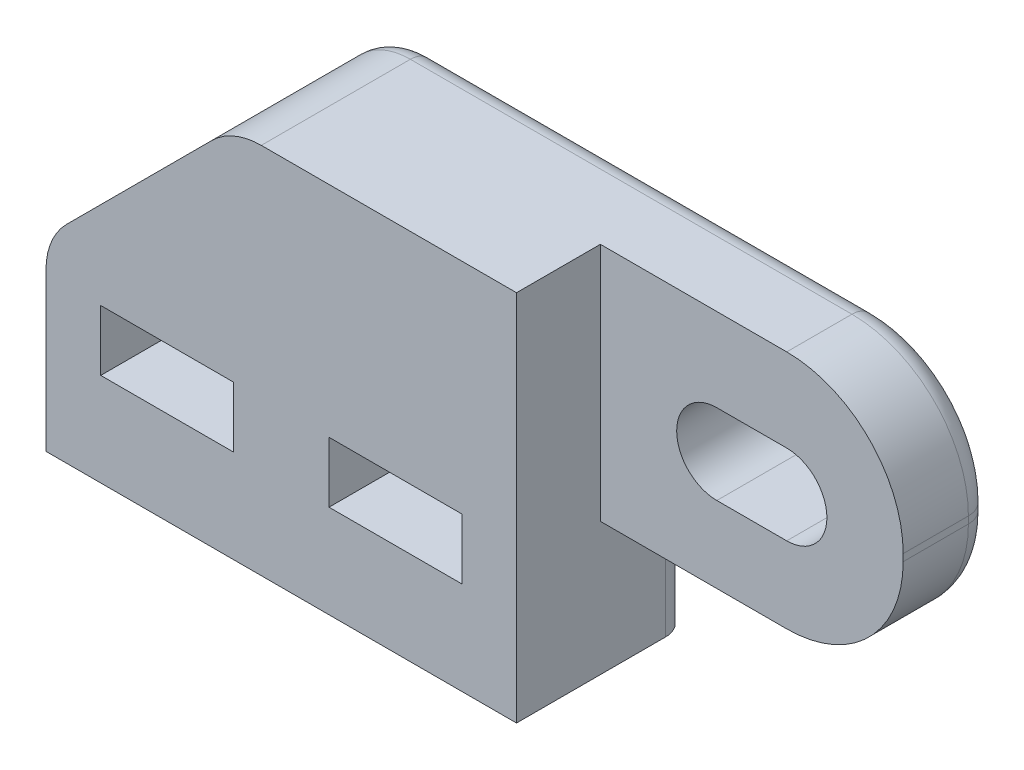
from build123d import *

# Parameters (mm, degrees)
BOSS_EXTRUDE1_DEPTH = 7.4
CUT_EXTRUDE1_REACH  = 39.59
SKETCH2_W           = 3.6
SKETCH2_H           = 10.3
SKETCH4_R           = 1.725
CUT_EXTRUDE3_DEPTH  = 9
SKETCH3_W           = 5.7
SKETCH3_H           = 2.6
CUT_EXTRUDE4_DEPTH  = 38.589892258
CHAMFER1_SIZE       = 8
FILLET4_R           = 3
FILLET5_R           = 5
FILLET6_R           = 1


with BuildPart() as part:
    # Sketch1 → Boss-Extrude1 (new body)
    with BuildSketch(Plane.XY):
        Polygon((0, 0), (20.2, 0), (20.2, 5.7), (33.2, 5.7), (33.2, 16), (0, 16), align=None)
        with BuildLine():
            Line((25.2, 12.425), (28.2, 12.425))
            ThreePointArc((28.2, 12.425), (29.925, 10.7), (28.2, 8.975))
            Line((28.2, 8.975), (25.2, 8.975))
            ThreePointArc((25.2, 8.975), (23.475, 10.7), (25.2, 12.425))
        make_face(mode=Mode.SUBTRACT)
    extrude(amount=BOSS_EXTRUDE1_DEPTH)

    # Cut-Extrude1: up to this face of the body (flat: up to its plane)
    cut_extrude1_end = Plane(part.part.faces().sort_by_distance((20.2, 2.85, 3.7))[0])
    # Sketch2 → Cut-Extrude1 (cut, up to the picked face)
    with BuildSketch(Plane(origin=(33.2, 0, 0), x_dir=(0, 0, -1), z_dir=(1, 0, 0)), mode=Mode.PRIVATE) as cut_extrude1_sk1:
        with Locations((-5.6, 10.85)):
            Rectangle(SKETCH2_W, SKETCH2_H)
    cut_extrude1_tool1 = split(extrude(cut_extrude1_sk1.sketch, amount=-CUT_EXTRUDE1_REACH, mode=Mode.PRIVATE), bisect_by=cut_extrude1_end, keep=Keep.BOTH, mode=Mode.PRIVATE)
    add(cut_extrude1_tool1.solids().sort_by(Axis((33.2, 10.85, 5.6), (-1, 0, 0)))[0], mode=Mode.SUBTRACT)

    # Sketch4 → Cut-Extrude3 (cut)
    with BuildSketch(Plane.XZ):
        with Locations(Location((15, 2.75, 0), (0, 0, 270))):
            Circle(SKETCH4_R)
        with Locations(Location((5.2, 2.75, 0), (0, 0, 270))):
            Circle(SKETCH4_R)
    extrude(amount=-CUT_EXTRUDE3_DEPTH, mode=Mode.SUBTRACT)

    # Sketch3 → Cut-Extrude4 (cut, through all)
    with BuildSketch(Plane(origin=(0, 0, 0), x_dir=(-1, 0, 0), z_dir=(0, 0, -1))):
        with Locations((-15, 5.3)):
            Rectangle(SKETCH3_W, SKETCH3_H)
        with Locations((-5.2, 5.3)):
            Rectangle(SKETCH3_W, SKETCH3_H)
    extrude(amount=-CUT_EXTRUDE4_DEPTH, mode=Mode.SUBTRACT)

    # Chamfer1
    chamfer1_edges = [part.edges().sort_by_distance(p)[0] for p in [
        (0, 16, 3.7),
    ]]
    chamfer(chamfer1_edges, length=CHAMFER1_SIZE)

    # Fillet4
    fillet4_edges = [part.edges().sort_by_distance(p)[0] for p in [
        (8, 16, 3.7),
        (0, 8, 3.7),
    ]]
    fillet(fillet4_edges, radius=FILLET4_R)

    # Fillet5
    fillet5_edges = [part.edges().sort_by_distance(p)[0] for p in [
        (33.2, 16, 1.9),
        (33.2, 5.7, 1.9),
    ]]
    fillet(fillet5_edges, radius=FILLET5_R)

    # Fillet6
    fillet6_edges = [part.edges().sort_by_distance(p)[0] for p in [
        (4, 12, 0),
        (0, 3.378679656, 0),
        (0.228361402, 7.90540961, 0),
        (8.09459039, 15.771638598, 0),
        (33.2, 10.85, 0),
        (18.721320344, 16, 0),
        (31.735533906, 14.535533906, 0),
        (31.735533906, 7.164466094, 0),
        (24.2, 5.7, 0),
        (20.2, 2.85, 0),
    ]]
    fillet(fillet6_edges, radius=FILLET6_R)


solid = part.part
